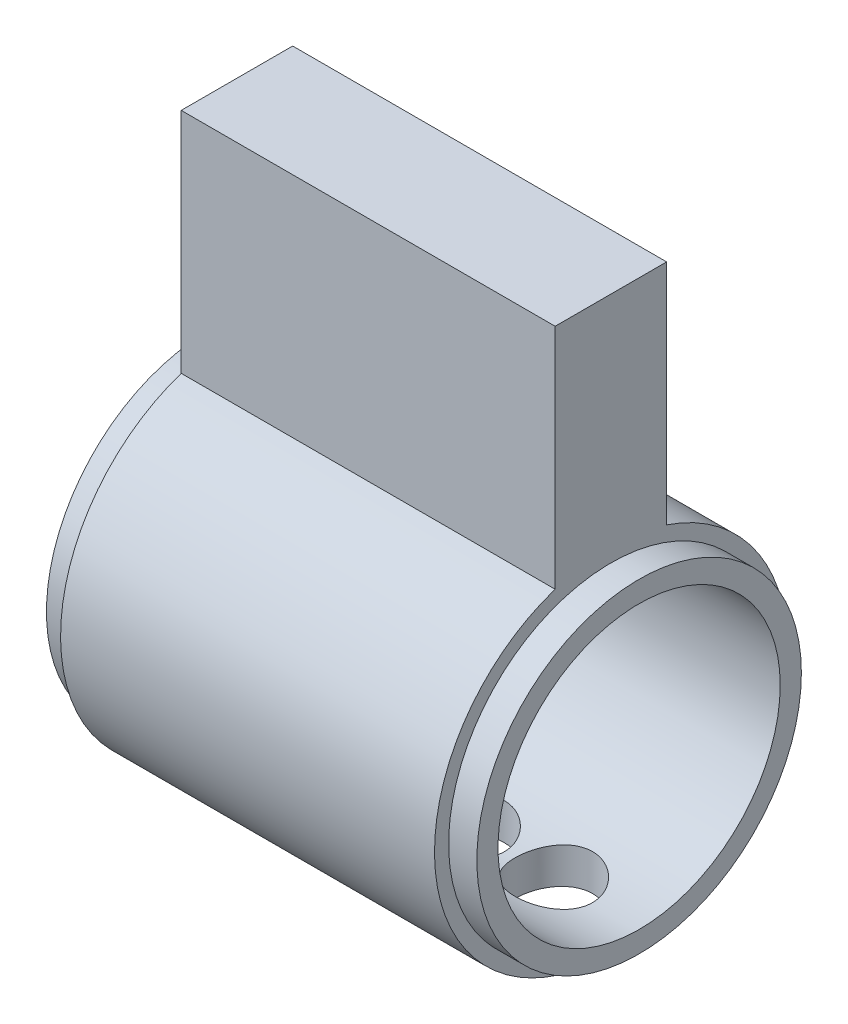
from build123d import *

# Parameters (mm, degrees)
SKETCH1_R                      = 6.35
SKETCH1_R_2                    = 5.08
BOSS_EXTRUDE1_DEPTH            = 15.494
BOSS_EXTRUDE2_DEPTH            = 13.462
SKETCH3_W                      = 1.016
SKETCH3_H                      = 0.508
BOSS_EXTRUDE3_DEPTH            = 1.27
SKETCH7_R                      = 1.397
CUT_EXTRUDE1_DEPTH             = 20.32
CUT_EXTRUDE4_REACH             = 23.971
CUT_EXTRUDE4_END_RADIUS        = 5.08
CUT_EXTRUDE4_DIRECTION_2_DEPTH = 0.635


with BuildPart() as part:
    # Sketch1 → Boss-Extrude1 (new body)
    with BuildSketch(Plane(origin=(0, 0, 0), x_dir=(0, 0, -1), z_dir=(1, 0, 0))):
        Circle(SKETCH1_R)
        Circle(SKETCH1_R_2, mode=Mode.SUBTRACT)
    extrude(amount=BOSS_EXTRUDE1_DEPTH)

    # Sketch2 → Boss-Extrude2 (add)
    with BuildSketch(Plane(origin=(1.016, 0, 0), x_dir=(0, 0, -1), z_dir=(1, 0, 0))):
        with BuildLine():
            Line((-2.0066, 6.024620854), (-2.0066, 14.224))
            Line((-2.0066, 14.224), (2.0066, 14.224))
            Line((2.0066, 14.224), (2.0066, 6.024620854))
            ThreePointArc((2.0066, 6.024620854), (0, 6.35), (-2.0066, 6.024620854))
        make_face()
    extrude(amount=BOSS_EXTRUDE2_DEPTH)

    # Sketch3 → Cut-Revolve1 (revolve, cut)
    with BuildSketch(Plane.XY, mode=Mode.PRIVATE) as cut_revolve1_sk:
        with Locations((14.986, 6.096)):
            Rectangle(SKETCH3_W, SKETCH3_H)
        with Locations((0.508, 6.096)):
            Rectangle(SKETCH3_W, SKETCH3_H)
    revolve(cut_revolve1_sk.sketch.rotate(Axis((15.494, 0, 0), (-1, 0, 0)), 90), axis=Axis((15.494, 0, 0), (-1, 0, 0)), mode=Mode.SUBTRACT)

    # Sketch5 → Boss-Extrude3 (add)
    with BuildSketch(Plane.ZY):
        with BuildLine():
            Line((4.709286039, 0.635), (4.709286039, -1.905))
            ThreePointArc((4.709286039, -1.905), (5.037440444, -0.656196444), (5.040156248, 0.635))
            Line((5.040156248, 0.635), (4.709286039, 0.635))
        make_face()
    extrude(amount=-BOSS_EXTRUDE3_DEPTH)

    # Sketch7 → Cut-Extrude1 (cut)
    with BuildSketch(Plane(origin=(0, -6.35, 0), x_dir=(1, 0, 0), z_dir=(0, 1, 0))):
        with Locations(Location((12.4206, 0, 0), (0, 0, 90))):
            Circle(SKETCH7_R)
        with Locations(Location((2.8956, 0, 0), (0, 0, 90))):
            Circle(SKETCH7_R)
        with Locations(Location((6.0706, 0, 0), (0, 0, 90))):
            Circle(SKETCH7_R)
        with Locations(Location((9.2456, 0, 0), (0, 0, 90))):
            Circle(SKETCH7_R)
    extrude(amount=CUT_EXTRUDE1_DEPTH, mode=Mode.SUBTRACT)

    # Cut-Extrude4: up to this cylinder (the profile starts inside it)
    cut_extrude4_end = Plane(origin=(0.846667, 0, 0), z_dir=(-1, 0, 0)) * Cylinder(CUT_EXTRUDE4_END_RADIUS, 59.102, mode=Mode.PRIVATE)
    # Sketch11 → Cut-Extrude4 (cut, up to the surface)
    with BuildSketch(Plane(origin=(0, 0, 0), x_dir=(1, 0, 0), z_dir=(0, 1, 0)), mode=Mode.PRIVATE) as cut_extrude4_sk1:
        Polygon((1.27, -4.709286039), (1.27, -5.040156248), (0, -4.709286039), align=None)
    cut_extrude4_tool1 = extrude(cut_extrude4_sk1.sketch, amount=-CUT_EXTRUDE4_REACH, mode=Mode.PRIVATE) & cut_extrude4_end
    add(cut_extrude4_tool1.solids().sort_by_distance((0.846667, 0, 4.819576))[0], mode=Mode.SUBTRACT)

    # Sketch11 → Cut-Extrude4 direction 2 (cut)
    with BuildSketch(Plane(origin=(0, 0, 0), x_dir=(1, 0, 0), z_dir=(0, 1, 0))):
        Polygon((1.27, -4.709286039), (1.27, -5.040156248), (0, -4.709286039), align=None)
    extrude(amount=CUT_EXTRUDE4_DIRECTION_2_DEPTH, mode=Mode.SUBTRACT)


solid = part.part
